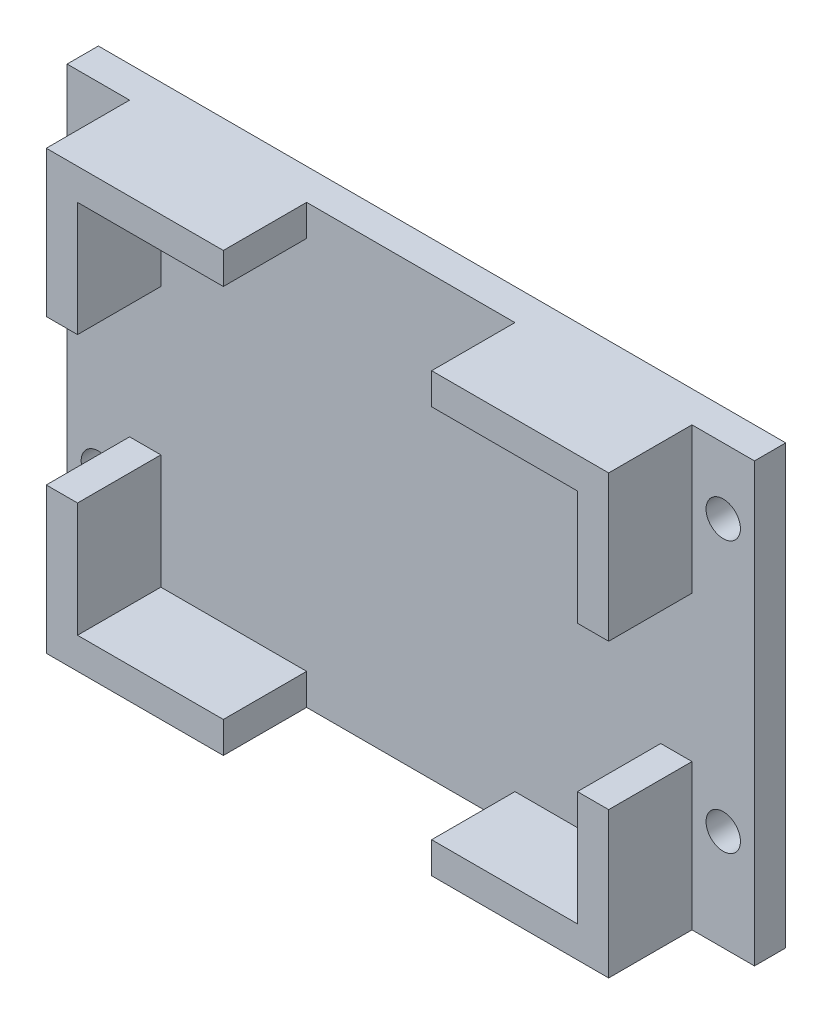
from build123d import *

# Parameters (mm, degrees)
SKETCH_1_R               = 1.65
EXTRUDE_3_DEPTH          = 3
SKETCH_3_W               = 54
SKETCH_3_H               = 42
SKETCH_3_W_2             = 48
SKETCH_3_H_2             = 36
EXTRUDE_4_DEPTH          = 8
CUT_EXTRUDE_1_DEPTH      = 55.534392818
CUT_EXTRUDE_1_DEPTH_BACK = 55.534392818
SKETCH_5_W               = 8
SKETCH_5_H               = 14
CUT_EXTRUDE_2_DEPTH      = 65.513564465


with BuildPart() as part:
    # 草图1 → 凸台-拉伸3 (new body)
    with BuildSketch(Plane.XY):
        Polygon((0, 21), (-30, 21), (-33, 21), (-33, -21), (33, -21), (33, 21), align=None)
        with Locations((-30, -11.316768896)):
            Circle(SKETCH_1_R, mode=Mode.SUBTRACT)
        with BuildLine():
            ThreePointArc((-30, 13.033231104), (-31.65, 14.683231104), (-30, 16.333231104))
            ThreePointArc((-30, 16.333231104), (-28.35, 14.683231104), (-30, 13.033231104))
        make_face(mode=Mode.SUBTRACT)
        with Locations((30, 14.683231104)):
            Circle(SKETCH_1_R, mode=Mode.SUBTRACT)
        with Locations((30, -11.316768896)):
            Circle(SKETCH_1_R, mode=Mode.SUBTRACT)
    extrude(amount=EXTRUDE_3_DEPTH)

    # 草图3 → 凸台-拉伸4 (add)
    with BuildSketch(Plane.XY.offset(3)):
        Rectangle(SKETCH_3_W, SKETCH_3_H)
        Rectangle(SKETCH_3_W_2, SKETCH_3_H_2, mode=Mode.SUBTRACT)
    extrude(amount=EXTRUDE_4_DEPTH)

    # 草图4 → 切除-拉伸1 (cut, two sides: drawn at the far end of the back side and taken through both)
    with BuildSketch(Plane.XZ.offset(21).offset(-CUT_EXTRUDE_1_DEPTH_BACK)):
        Polygon((-10, 109.769364085), (-10, 11), (-10, 3), (10, 3), (10, 11), (10, 109.769364085), (10, 307.308092254), (-10, 307.308092254), align=None)
    extrude(amount=CUT_EXTRUDE_1_DEPTH + CUT_EXTRUDE_1_DEPTH_BACK, mode=Mode.SUBTRACT)

    # 草图5 → 切除-拉伸2 (cut, through all)
    with BuildSketch(Plane.ZY.offset(27)):
        with Locations((7, 0)):
            Rectangle(SKETCH_5_W, SKETCH_5_H)
    extrude(amount=-CUT_EXTRUDE_2_DEPTH, mode=Mode.SUBTRACT)


solid = part.part
